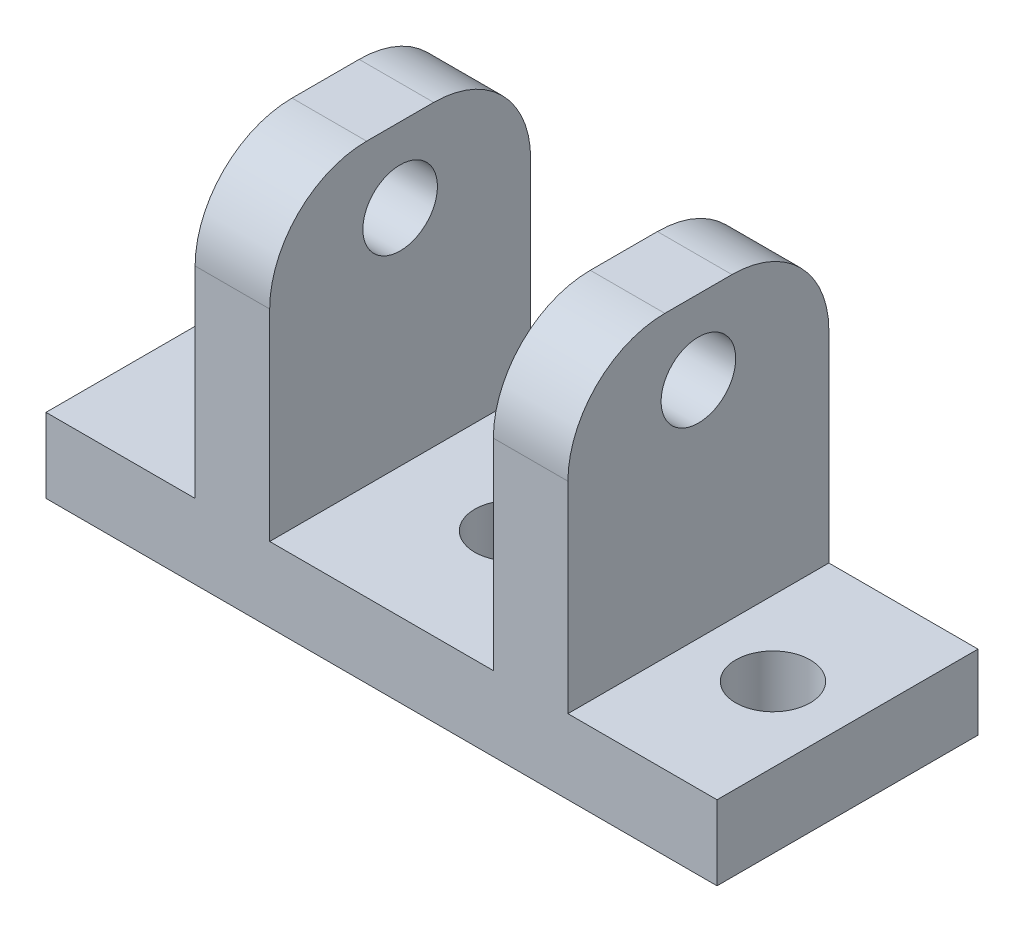
from build123d import *

# Parameters (mm, degrees)
SKETCH2_W                       = 12.7
SKETCH2_H                       = 22.225
BOSS_EXTRUDE1_DEPTH             = 6.35
SKETCH2_W_2                     = 19.05
BOSS_EXTRUDE1_2_DEPTH           = 6.35
BOSS_EXTRUDE1_3_DEPTH           = 6.35
SKETCH2_3_W                     = 6.35
SKETCH2_3_H                     = 22.225
BOSS_EXTRUDE2_DEPTH             = 31.75
SKETCH3_R                       = 3.175
CUT_EXTRUDE1_DEPTH              = 59.973007597
F_1_4_0_25_DIAMETER_HOLE1_D     = 6.35
F_1_4_0_25_DIAMETER_HOLE1_DEPTH = 25.4
F_1_4_0_25_DIAMETER_HOLE1_TIP   = 1.907732465
FILLET1_R                       = 8.255


with BuildPart() as part:
    # Sketch2 → Boss-Extrude1 (new body)
    with BuildSketch(Plane(origin=(0, 0, 0), x_dir=(1, 0, 0), z_dir=(0, 1, 0))):
        with Locations((6.35, 11.1125)):
            Rectangle(SKETCH2_W, SKETCH2_H)
    extrude(amount=BOSS_EXTRUDE1_DEPTH)



with BuildPart() as body_2:
    # Sketch2 → Boss-Extrude1 2 (new body)
    with BuildSketch(Plane(origin=(0, 0, 0), x_dir=(1, 0, 0), z_dir=(0, 1, 0))):
        with Locations((28.575, 11.1125)):
            Rectangle(SKETCH2_W_2, SKETCH2_H)
    extrude(amount=BOSS_EXTRUDE1_2_DEPTH)


with BuildPart() as body_3:
    # Sketch2 → Boss-Extrude1 3 (new body)
    with BuildSketch(Plane(origin=(0, 0, 0), x_dir=(1, 0, 0), z_dir=(0, 1, 0))):
        with Locations((50.8, 11.1125)):
            Rectangle(SKETCH2_W, SKETCH2_H)
    extrude(amount=BOSS_EXTRUDE1_3_DEPTH)


with BuildPart() as part_1:
    add(part.part)

    add(body_2.part)  # Boss-Extrude2 merges body 2

    add(body_3.part)  # Boss-Extrude2 merges body 3
    # Sketch2<3> → Boss-Extrude2 (add)
    with BuildSketch(Plane(origin=(0, 0, 0), x_dir=(1, 0, 0), z_dir=(0, 1, 0))):
        with Locations((15.875, 11.1125)):
            Rectangle(SKETCH2_3_W, SKETCH2_3_H)
        with Locations((41.275, 11.1125)):
            Rectangle(SKETCH2_3_W, SKETCH2_3_H)
    extrude(amount=BOSS_EXTRUDE2_DEPTH)

    # Sketch3 → Cut-Extrude1 (cut, through all)
    with BuildSketch(Plane.ZY.offset(-12.7)):
        with Locations((-11.1125, 25.4)):
            Circle(SKETCH3_R)
    extrude(amount=-CUT_EXTRUDE1_DEPTH, mode=Mode.SUBTRACT)

    # 1/4 (0.25) Diameter Hole1
    with Locations(Plane(origin=(6.35, 6.35, -11.1125), x_dir=(0, 0, 1), z_dir=(0, 1, 0))):
        with Locations((0, 0), (0, 22.225), (0, 44.45)):
            Hole(F_1_4_0_25_DIAMETER_HOLE1_D / 2, depth=F_1_4_0_25_DIAMETER_HOLE1_DEPTH)
            with Locations((0, 0, -(F_1_4_0_25_DIAMETER_HOLE1_DEPTH + F_1_4_0_25_DIAMETER_HOLE1_TIP / 2))):  # 118° drill point
                Cone(0, F_1_4_0_25_DIAMETER_HOLE1_D / 2, F_1_4_0_25_DIAMETER_HOLE1_TIP, mode=Mode.SUBTRACT)

    # Fillet1
    fillet1_edges = [part_1.edges().sort_by_distance(p)[0] for p in [
        (15.875, 31.75, -22.225),
        (41.275, 31.75, -22.225),
        (41.275, 31.75, 0),
        (15.875, 31.75, 0),
    ]]
    fillet(fillet1_edges, radius=FILLET1_R)


solid = part_1.part
